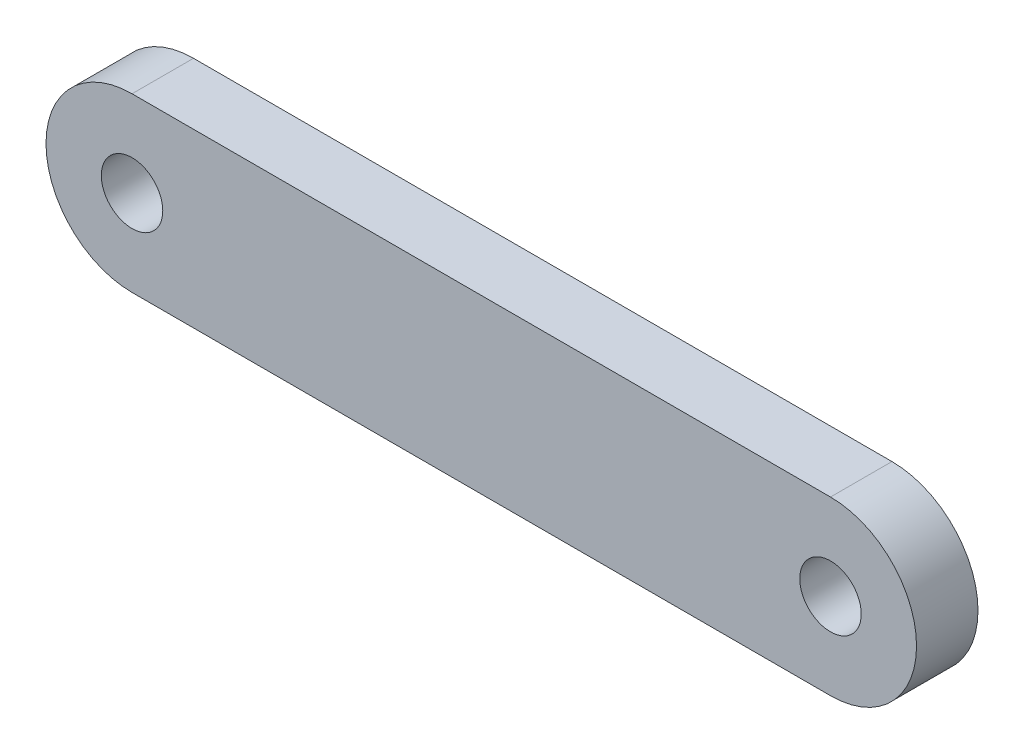
from build123d import *

# Parameters (mm, degrees)
SKETCH1_R           = 3.175
BOSS_EXTRUDE1_DEPTH = 6.35


with BuildPart() as part:
    # Sketch1 → Boss-Extrude1 (new body)
    with BuildSketch(Plane.XY):
        with BuildLine():
            Line((-18.712193521, -8.636495621), (53.456806479, -8.636495621))
            ThreePointArc((53.456806479, -8.636495621), (62.346806479, 0.253504379), (53.456806479, 9.143504379))
            Line((53.456806479, 9.143504379), (-18.712193521, 9.143504379))
            ThreePointArc((-18.712193521, 9.143504379), (-27.602193521, 0.253504379), (-18.712193521, -8.636495621))
        make_face()
        with Locations((-18.712193521, 0.253504379)):
            Circle(SKETCH1_R, mode=Mode.SUBTRACT)
        with Locations((53.456806479, 0.253504379)):
            Circle(SKETCH1_R, mode=Mode.SUBTRACT)
    extrude(amount=BOSS_EXTRUDE1_DEPTH)


solid = part.part
